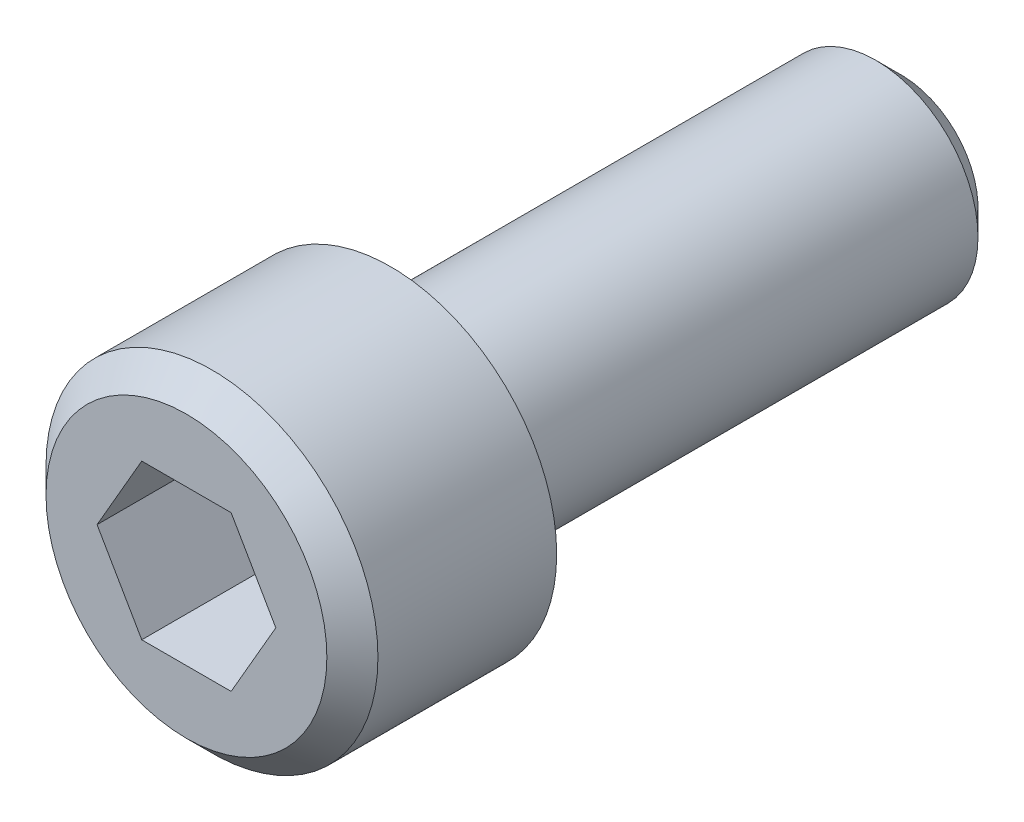
from build123d import *

# Parameters (mm, degrees)
CROQUIS1_R              = 6.5
SALIENTE_EXTRUIR1_DEPTH = 8
CROQUIS2_R              = 4
SALIENTE_EXTRUIR2_DEPTH = 20
CHAFL_N1_SIZE           = 1
CORTAR_EXTRUIR1_DEPTH   = 6


with BuildPart() as part:
    # Croquis1 → Saliente-Extruir1 (new body)
    with BuildSketch(Plane.XY):
        Circle(CROQUIS1_R)
    extrude(amount=SALIENTE_EXTRUIR1_DEPTH)

    # Croquis2 → Saliente-Extruir2 (add)
    with BuildSketch(Plane(origin=(0, 0, 0), x_dir=(-1, 0, 0), z_dir=(0, 0, -1))):
        with Locations(Location((0, 0, 0), (0, 0, 180))):
            Circle(CROQUIS2_R)
    extrude(amount=SALIENTE_EXTRUIR2_DEPTH)

    # Chaflán1
    chafl_n1_edges = [part.edges().sort_by_distance(p)[0] for p in [
        (-6.5, 0, 8),
        (-4, 0, -20),
    ]]
    chamfer(chafl_n1_edges, length=CHAFL_N1_SIZE)

    # Croquis3 → Cortar-Extruir1 (cut)
    with BuildSketch(Plane.XY.offset(8)):
        Polygon((3.5, 0), (1.75, 3.031088913), (-1.75, 3.031088913), (-3.5, 0), (-1.75, -3.031088913), (1.75, -3.031088913), align=None)
    extrude(amount=-CORTAR_EXTRUIR1_DEPTH, mode=Mode.SUBTRACT)


solid = part.part
